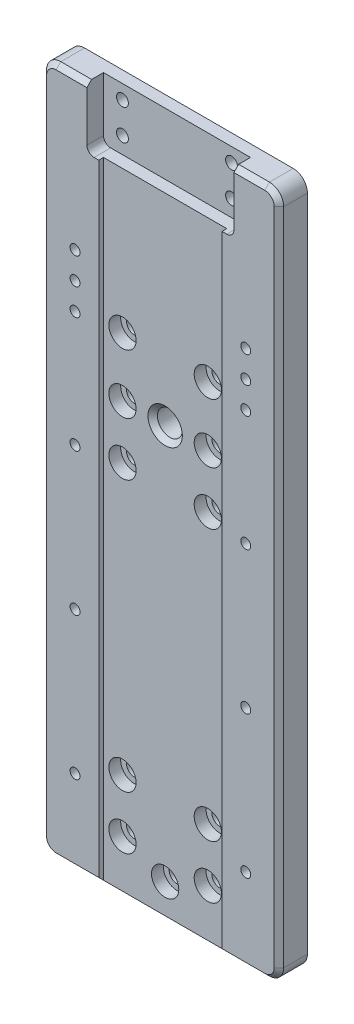
from build123d import *

# Parameters (mm, degrees)
SKETCH1_W           = 100
SKETCH1_H           = 290
BOSS_EXTRUDE1_DEPTH = 6
SKETCH2_W           = 62
SKETCH2_H           = 26
CUT_EXTRUDE1_DEPTH  = 7
SKETCH3_W           = 52
SKETCH3_H           = 290
CUT_EXTRUDE2_DEPTH  = 2
SKETCH4_R           = 2.5
SKETCH4_R_2         = 5.25
SKETCH4_R_3         = 3.3
SKETCH4_R_4         = 2.1
CUT_EXTRUDE4_DEPTH  = 21
FILLET1_R           = 3
FILLET2_R           = 6
CHAMFER1_SIZE       = 2
SKETCH5_R           = 5.75
CUT_EXTRUDE5_DEPTH  = 5
CHAMFER2_SIZE       = 2


with BuildPart() as part:
    # Sketch1 → Boss-Extrude1 (new, symmetric)
    with BuildSketch(Plane.XY):
        Rectangle(SKETCH1_W, SKETCH1_H)
    extrude(amount=BOSS_EXTRUDE1_DEPTH, both=True)

    # Sketch2 → Cut-Extrude1 (cut)
    with BuildSketch(Plane.XY.offset(6)):
        with Locations((0, 132)):
            Rectangle(SKETCH2_W, SKETCH2_H)
    extrude(amount=-CUT_EXTRUDE1_DEPTH, mode=Mode.SUBTRACT)

    # Sketch3 → Cut-Extrude2 (cut)
    with BuildSketch(Plane.XY.offset(6)):
        Rectangle(SKETCH3_W, SKETCH3_H)
    extrude(amount=-CUT_EXTRUDE2_DEPTH, mode=Mode.SUBTRACT)

    # Sketch4 → Cut-Extrude4 (cut)
    with BuildSketch(Plane.XY.offset(-6)):
        with Locations((-23, 139)):
            Circle(SKETCH4_R)
        with Locations((23, 139)):
            Circle(SKETCH4_R)
        with Locations((23, 126)):
            Circle(SKETCH4_R)
        with Locations((-23, 126)):
            Circle(SKETCH4_R)
        with Locations(Location((0, 34, 0), (0, 0, 180))):
            Circle(SKETCH4_R_2)
        with Locations(Location((-18, 59, 0), (0, 0, 180))):
            Circle(SKETCH4_R_3)
        with Locations(Location((-18, 34, 0), (0, 0, 180))):
            Circle(SKETCH4_R_3)
        with Locations(Location((-18, 11.5, 0), (0, 0, 180))):
            Circle(SKETCH4_R_3)
        with Locations((-36, 81.25)):
            Circle(SKETCH4_R_4)
        with Locations((-36, 70)):
            Circle(SKETCH4_R_4)
        with Locations((-36, 58.75)):
            Circle(SKETCH4_R_4)
        with Locations((-36, 10)):
            Circle(SKETCH4_R_4)
        with Locations((-36, -110)):
            Circle(SKETCH4_R_4)
        with Locations((-36, -50)):
            Circle(SKETCH4_R_4)
        with Locations(Location((-18, -102.5, 0), (0, 0, 180))):
            Circle(SKETCH4_R_3)
        with Locations(Location((-18, -125, 0), (0, 0, 180))):
            Circle(SKETCH4_R_3)
        with Locations(Location((18, -102.5, 0), (0, 0, 180))):
            Circle(SKETCH4_R_3)
        with Locations(Location((18, -125, 0), (0, 0, 180))):
            Circle(SKETCH4_R_3)
        with Locations(Location((0, -132.5, 0), (0, 0, 180))):
            Circle(SKETCH4_R_3)
        with Locations(Location((36, 81.25, 0), (0, 0, 180))):
            Circle(SKETCH4_R_4)
        with Locations(Location((36, 70, 0), (0, 0, 180))):
            Circle(SKETCH4_R_4)
        with Locations(Location((36, 58.75, 0), (0, 0, 180))):
            Circle(SKETCH4_R_4)
        with Locations(Location((18, 59, 0), (0, 0, 180))):
            Circle(SKETCH4_R_3)
        with Locations(Location((18, 11.5, 0), (0, 0, 180))):
            Circle(SKETCH4_R_3)
        with Locations(Location((18, 34, 0), (0, 0, 180))):
            Circle(SKETCH4_R_3)
        with Locations(Location((36, 10, 0), (0, 0, 180))):
            Circle(SKETCH4_R_4)
        with Locations(Location((36, -50, 0), (0, 0, 180))):
            Circle(SKETCH4_R_4)
        with Locations(Location((36, -110, 0), (0, 0, 180))):
            Circle(SKETCH4_R_4)
    extrude(amount=CUT_EXTRUDE4_DEPTH, mode=Mode.SUBTRACT)

    # Fillet1
    fillet1_edges = [part.edges().sort_by_distance(p)[0] for p in [
        (-31, 119, 2.5),
        (31, 119, 2.5),
    ]]
    fillet(fillet1_edges, radius=FILLET1_R)

    # Fillet2
    fillet2_edges = [part.edges().sort_by_distance(p)[0] for p in [
        (-50, 145, 0),
        (50, 145, 0),
        (50, -145, 0),
        (-50, -145, 0),
    ]]
    fillet(fillet2_edges, radius=FILLET2_R)

    # Chamfer1
    chamfer1_edges = [part.edges().sort_by_distance(p)[0] for p in [
        (35, -145, 6),
        (48.242640687, -143.242640687, 6),
        (50, 0, 6),
        (48.242640687, 143.242640687, 6),
        (37.5, 145, 6),
        (-35, -145, 6),
        (-48.242640687, -143.242640687, 6),
        (-50, 0, 6),
        (-48.242640687, 143.242640687, 6),
        (-37.5, 145, 6),
    ]]
    chamfer(chamfer1_edges, length=CHAMFER1_SIZE)

    # Sketch5 → Cut-Extrude5 (cut)
    with BuildSketch(Plane.XY.offset(4)):
        with Locations((-18, 59)):
            Circle(SKETCH5_R)
        with Locations((-18, 34)):
            Circle(SKETCH5_R)
        with Locations((-18, 11.5)):
            Circle(SKETCH5_R)
        with Locations((18, 11.5)):
            Circle(SKETCH5_R)
        with Locations((18, 34)):
            Circle(SKETCH5_R)
        with Locations((18, 59)):
            Circle(SKETCH5_R)
        with Locations((18, -102.5)):
            Circle(SKETCH5_R)
        with Locations((-18, -102.5)):
            Circle(SKETCH5_R)
        with Locations((-18, -125)):
            Circle(SKETCH5_R)
        with Locations((0, -132.5)):
            Circle(SKETCH5_R)
        with Locations((18, -125)):
            Circle(SKETCH5_R)
    extrude(amount=-CUT_EXTRUDE5_DEPTH, mode=Mode.SUBTRACT)

    # Chamfer2
    chamfer2_edges = [part.edges().sort_by_distance(p)[0] for p in [
        (5.25, 34, 4),
    ]]
    chamfer(chamfer2_edges, length=CHAMFER2_SIZE)


solid = part.part
